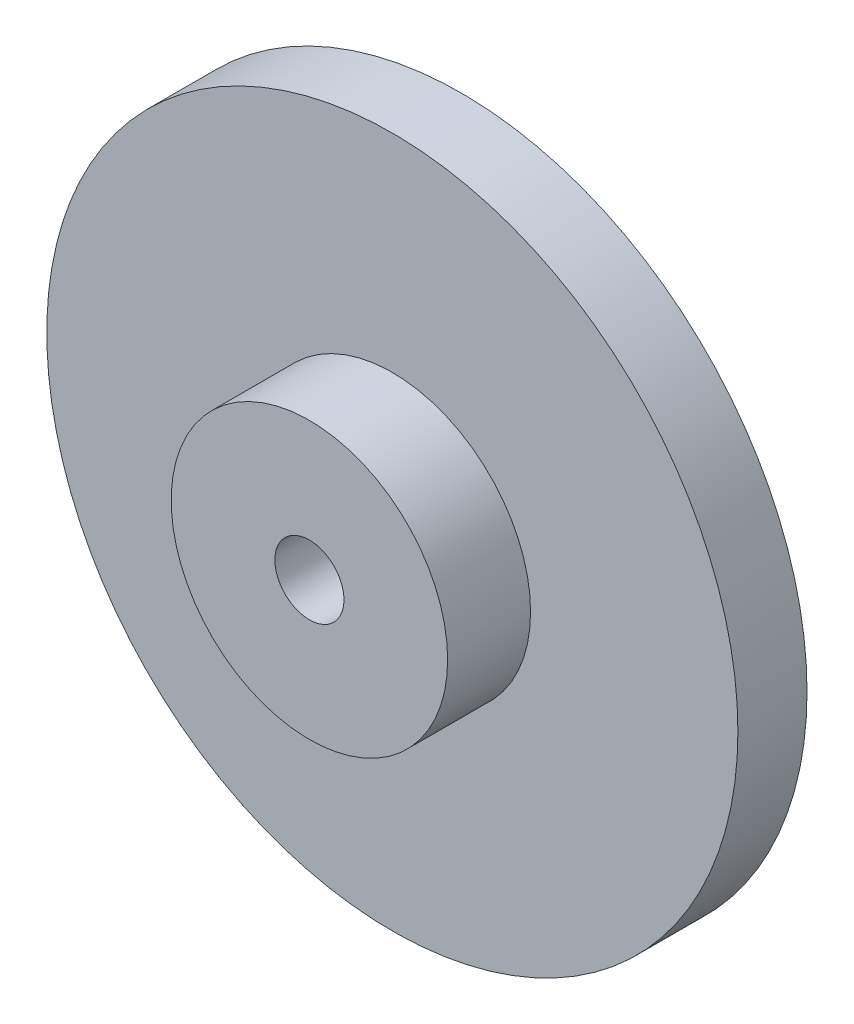
from build123d import *

# Parameters (mm, degrees)
ESQUISSE1_R             = 25
BOSS_EXTRU_1_DEPTH      = 5
ESQUISSE2_R             = 10
BOSS_EXTRU_2_DEPTH      = 6
ESQUISSE3_R             = 2.5
ENL_V_MAT_EXTRU_1_DEPTH = 38.027017163


with BuildPart() as part:
    # Esquisse1 → Boss.-Extru.1 (new body)
    with BuildSketch(Plane.XY):
        Circle(ESQUISSE1_R)
    extrude(amount=BOSS_EXTRU_1_DEPTH)

    # Esquisse2 → Boss.-Extru.2 (add)
    with BuildSketch(Plane.XY.offset(5)):
        Circle(ESQUISSE2_R)
    extrude(amount=BOSS_EXTRU_2_DEPTH)

    # Esquisse3 → Enlèv. mat.-Extru.1 (cut, through all)
    with BuildSketch(Plane.XY.offset(11)):
        Circle(ESQUISSE3_R)
    extrude(amount=-ENL_V_MAT_EXTRU_1_DEPTH, mode=Mode.SUBTRACT)


solid = part.part
